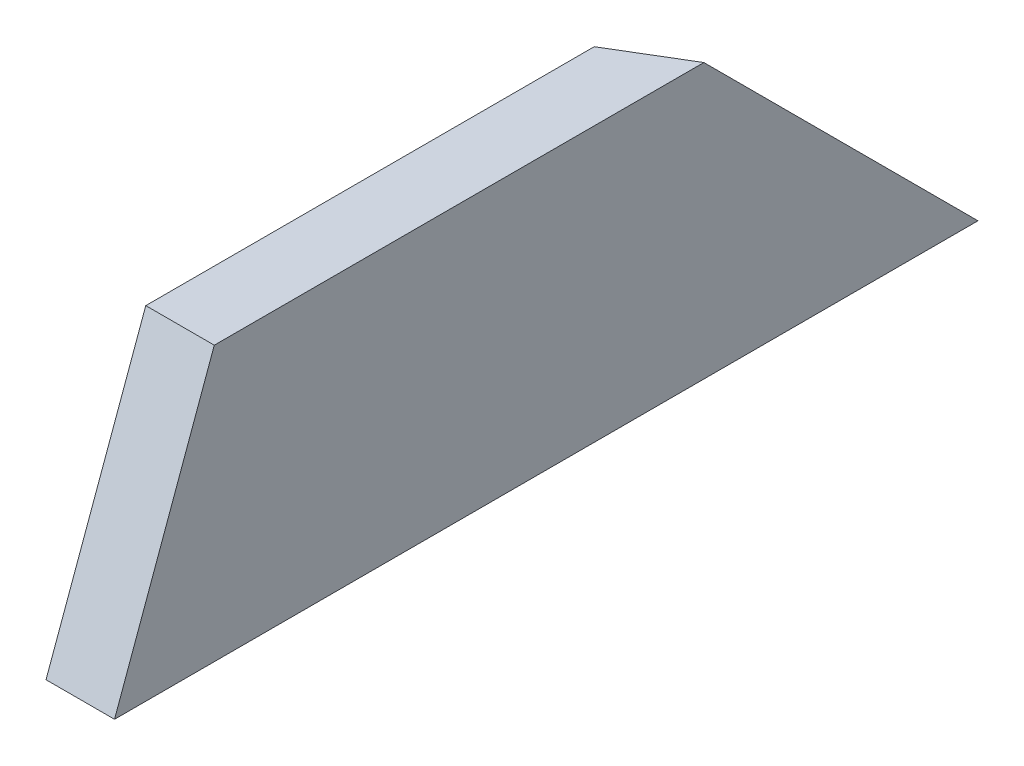
from build123d import *

# Parameters (mm, degrees)
BOSS_EXTRUDE1_DEPTH = 12.7
CUT_EXTRUDE3_DEPTH  = 101.600000001


with BuildPart() as part:
    # Sketch1 → Boss-Extrude1 (new body)
    with BuildSketch(Plane(origin=(0, 0, 0), x_dir=(0, 0, -1), z_dir=(1, 0, 0))):
        Polygon((-80.01, 0), (80.01, 0), (29.21, 50.8), (-61.520312099, 50.8), align=None)
    extrude(amount=BOSS_EXTRUDE1_DEPTH)

    # Sketch6 → Cut-Extrude3 (cut, along a direction that is not the sketch's normal)
    with BuildSketch(Plane.XZ):
        Polygon((0, -80.01), (12.7, -80.01), (0, -72.39), align=None)
    extrude(amount=-CUT_EXTRUDE3_DEPTH, dir=(0, -0.7071067811865436, -0.7071067811865515), mode=Mode.SUBTRACT)


solid = part.part
